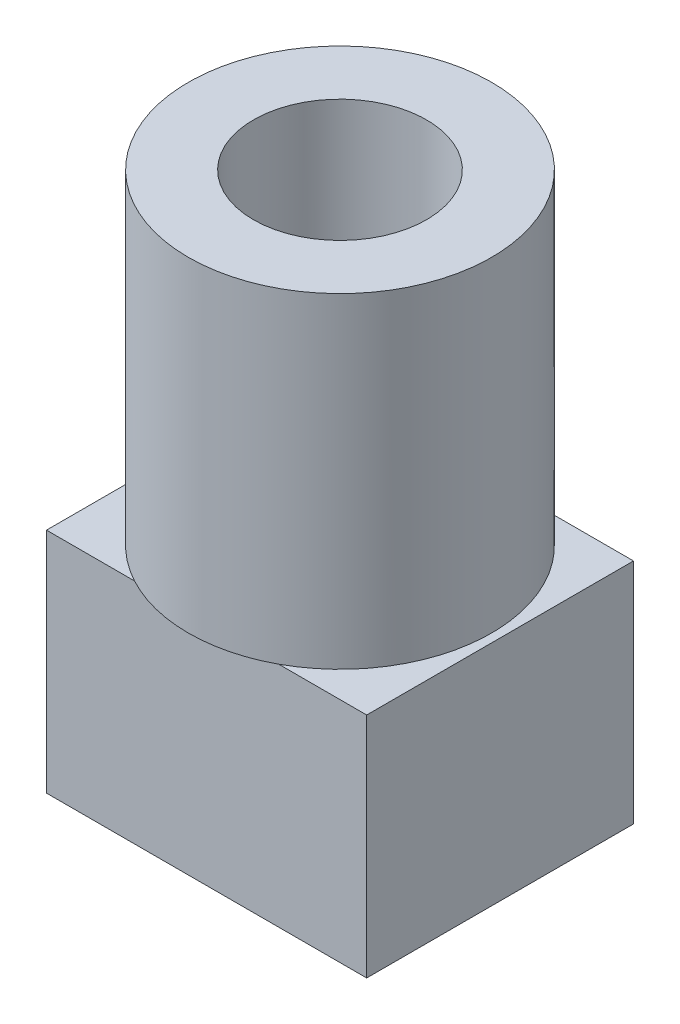
from build123d import *

# Parameters (mm, degrees)
SKETCH2_W           = 9.84
SKETCH2_H           = 8.2
BOSS_EXTRUDE1_DEPTH = 7
SKETCH3_W           = 5.84
SKETCH3_H           = 4.2
CUT_EXTRUDE1_DEPTH  = 15.596766765
SKETCH4_R           = 4.66
BOSS_EXTRUDE2_DEPTH = 10
SKETCH5_R           = 2.66
CUT_EXTRUDE2_DEPTH  = 10


with BuildPart() as part:
    # Sketch2 → Boss-Extrude1 (new body)
    with BuildSketch(Plane(origin=(0, 0, 0), x_dir=(1, 0, 0), z_dir=(0, 1, 0))):
        with Locations((4.92, 4.1)):
            Rectangle(SKETCH2_W, SKETCH2_H)
    extrude(amount=BOSS_EXTRUDE1_DEPTH)

    # Sketch3 → Cut-Extrude1 (cut, through all)
    with BuildSketch(Plane(origin=(0, 7, 0), x_dir=(1, 0, 0), z_dir=(0, 1, 0))):
        with Locations((4.92, 4.1)):
            Rectangle(SKETCH3_W, SKETCH3_H)
    extrude(amount=-CUT_EXTRUDE1_DEPTH, mode=Mode.SUBTRACT)

    # Sketch4 → Boss-Extrude2 (add)
    with BuildSketch(Plane(origin=(0, 7, 0), x_dir=(1, 0, 0), z_dir=(0, 1, 0))):
        with Locations(Location((4.92, 4.1, 0), (0, 0, 61.621661447))):
            Circle(SKETCH4_R)
    extrude(amount=BOSS_EXTRUDE2_DEPTH)

    # Sketch5 → Cut-Extrude2 (cut)
    with BuildSketch(Plane(origin=(0, 17, 0), x_dir=(1, 0, 0), z_dir=(0, 1, 0))):
        with Locations(Location((4.92, 4.1, 0), (0, 0, 270))):
            Circle(SKETCH5_R)
    extrude(amount=-CUT_EXTRUDE2_DEPTH, mode=Mode.SUBTRACT)


solid = part.part
